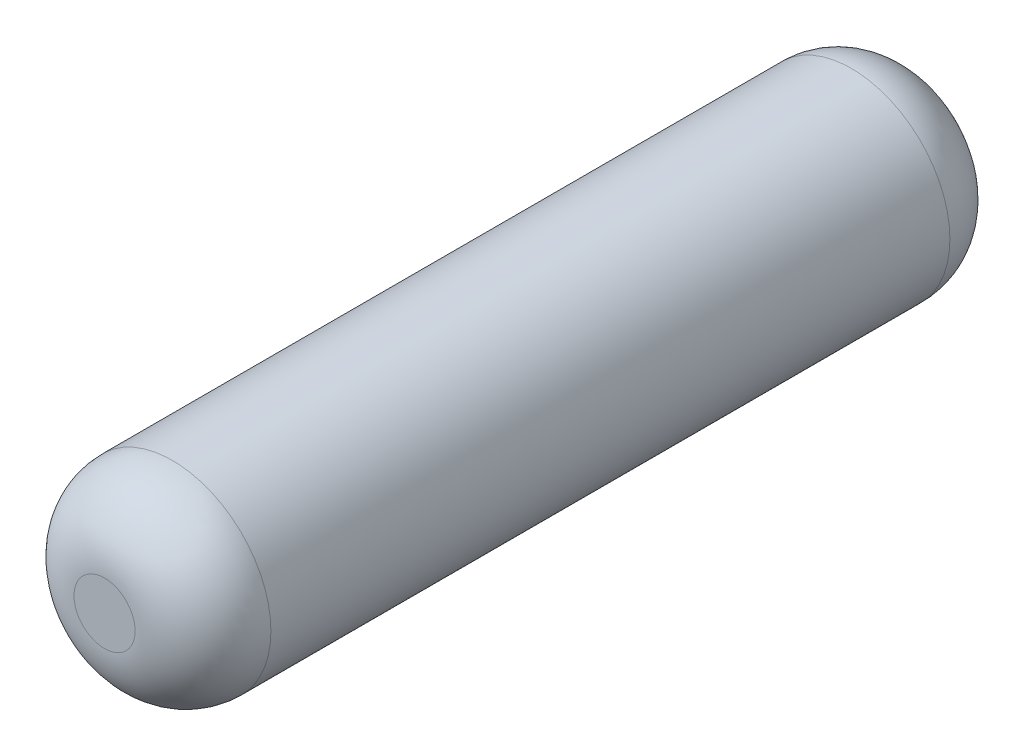
from build123d import *

# Parameters (mm, degrees)
SKETCH1_R           = 1.45
BOSS_EXTRUDE1_DEPTH = 12
FILLET1_R           = 1
SCALE1_SCALE        = 0.7


with BuildPart() as part:
    # Sketch1 → Boss-Extrude1 (new body)
    with BuildSketch(Plane(origin=(0, 0, 0), x_dir=(0, 1, 0), z_dir=(0, 0, 1))):
        with Locations(Location((0, 0, 0), (0, 0, 270))):
            Circle(SKETCH1_R)
    extrude(amount=-BOSS_EXTRUDE1_DEPTH)

    # Fillet1
    fillet1_edges = [part.edges().sort_by_distance(p)[0] for p in [
        (-1.45, 0, 0),
        (-1.45, 0, -12),
    ]]
    fillet(fillet1_edges, radius=FILLET1_R)


with BuildPart() as part_1:
    # Scale1: scaled about (0, 0, -6)
    add(part.part.scale(SCALE1_SCALE).moved(Location((0, 0, -1.8))))


solid = part_1.part
